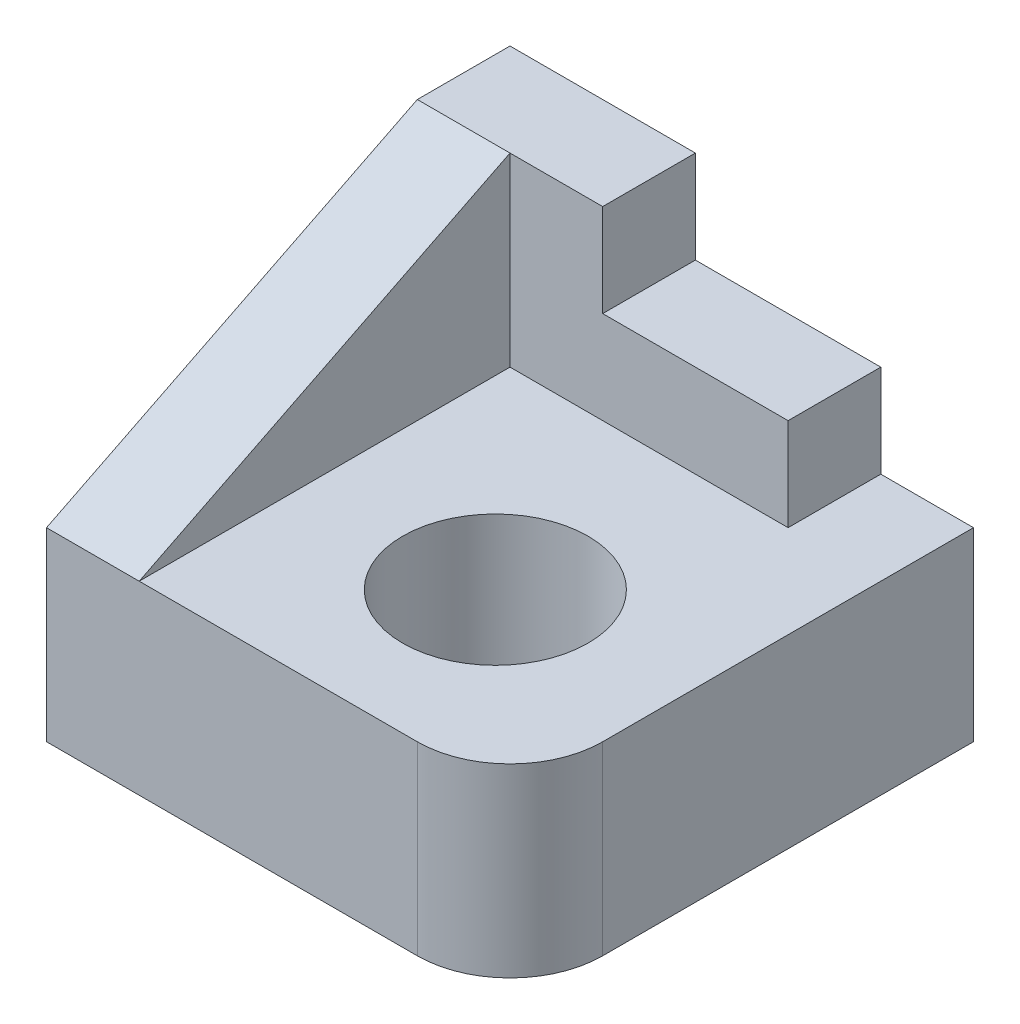
from build123d import *

# Parameters (mm, degrees)
SKETCH1_R           = 10
BOSS_EXTRUDE1_DEPTH = 20
BOSS_EXTRUDE2_DEPTH = 10
BOSS_EXTRUDE3_DEPTH = 10


with BuildPart() as part:
    # Sketch1 → Boss-Extrude1 (new body)
    with BuildSketch(Plane(origin=(0, 0, 0), x_dir=(1, 0, 0), z_dir=(0, 1, 0))):
        with BuildLine():
            Line((-30, 31.581015912), (20, 31.581015912))
            Line((20, 31.581015912), (20, -8.418984088))
            ThreePointArc((20, -8.418984088), (17.071067812, -15.4900519), (10, -18.418984088))
            Line((10, -18.418984088), (-30, -18.418984088))
            Line((-30, -18.418984088), (-30, 31.581015912))
        make_face()
        with Locations(Location((0, 0, 0), (0, 0, 270))):
            Circle(SKETCH1_R, mode=Mode.SUBTRACT)
    extrude(amount=BOSS_EXTRUDE1_DEPTH)

    # Sketch2 → Boss-Extrude2 (add)
    with BuildSketch(Plane.ZY.offset(30)):
        Polygon((18.418984088, 20), (-21.581015912, 20), (-21.581015912, 40), align=None)
    extrude(amount=-BOSS_EXTRUDE2_DEPTH)

    # Sketch3 → Boss-Extrude3 (add)
    with BuildSketch(Plane(origin=(0, 0, -31.581015912), x_dir=(-1, 0, 0), z_dir=(0, 0, -1))):
        Polygon((30, 20), (30, 40), (10, 40), (10, 30), (-10, 30), (-10, 20), align=None)
    extrude(amount=-BOSS_EXTRUDE3_DEPTH)


solid = part.part
